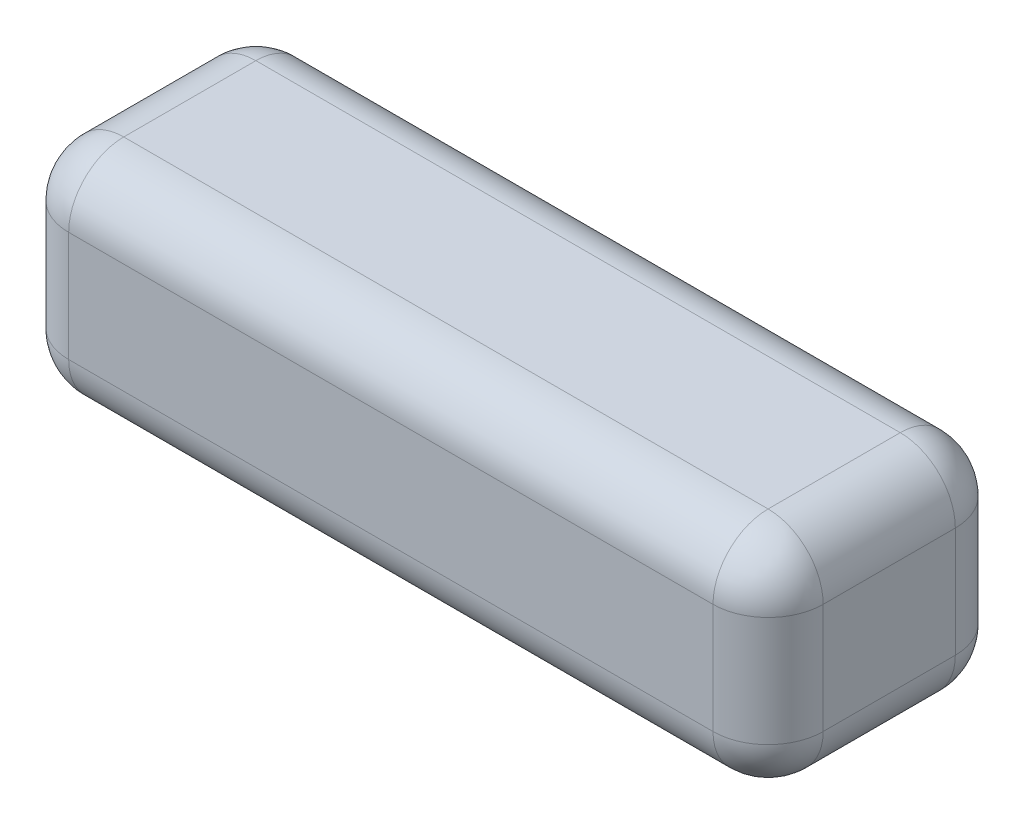
from build123d import *

# Parameters (mm, degrees)
SKETCH1_W           = 137
SKETCH1_H           = 44
BOSS_EXTRUDE1_DEPTH = 40
FILLET1_R           = 10


with BuildPart() as part:
    # Sketch1 → Boss-Extrude1 (new body)
    with BuildSketch(Plane(origin=(0, 0, 0), x_dir=(1, 0, 0), z_dir=(0, 1, 0))):
        with Locations((35.814285714, -3.631746032)):
            Rectangle(SKETCH1_W, SKETCH1_H)
    extrude(amount=BOSS_EXTRUDE1_DEPTH)

    # Fillet1
    fillet1_edges = [part.edges().sort_by_distance(p)[0] for p in [
        (104.314285714, 40, 3.631746032),
        (35.814285714, 40, -18.368253968),
        (-32.685714286, 40, 3.631746032),
        (35.814285714, 0, -18.368253968),
        (104.314285714, 0, 3.631746032),
        (35.814285714, 0, 25.631746032),
        (-32.685714286, 0, 3.631746032),
        (-32.685714286, 20, -18.368253968),
        (104.314285714, 20, -18.368253968),
        (104.314285714, 20, 25.631746032),
        (-32.685714286, 20, 25.631746032),
        (35.814285714, 40, 25.631746032),
    ]]
    fillet(fillet1_edges, radius=FILLET1_R)


solid = part.part
